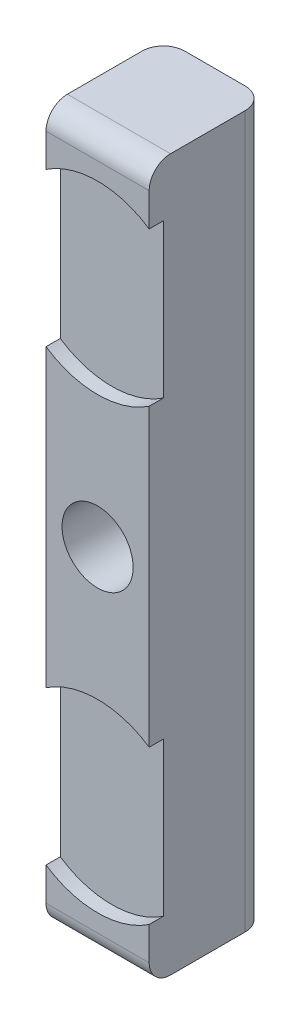
from build123d import *

# Parameters (mm, degrees)
SKETCH7_W           = 100
SKETCH7_H           = 14.5
BOSS_EXTRUDE1_DEPTH = 16.5
SKETCH8_R           = 5
CUT_EXTRUDE2_DEPTH  = 13
SKETCH10_R          = 13
CUT_EXTRUDE3_DEPTH  = 2
FILLET1_R           = 3
FILLET3_R           = 3
FILLET4_R           = 3
FILLET5_R           = 3


with BuildPart() as part:
    # Sketch7 → Boss-Extrude1 (new body)
    with BuildSketch(Plane(origin=(0, 0, 0), x_dir=(0, 1, 0), z_dir=(0, 0, 1))):
        Rectangle(SKETCH7_W, SKETCH7_H)
    extrude(amount=BOSS_EXTRUDE1_DEPTH)

    # Sketch8 → Cut-Extrude2 (cut)
    with BuildSketch(Plane(origin=(0, 0, 16.5), x_dir=(0, -1, 0), z_dir=(0, 0, 1))):
        with Locations(Location((0, 0, 0), (0, 0, 90))):
            Circle(SKETCH8_R)
    extrude(amount=-CUT_EXTRUDE2_DEPTH, mode=Mode.SUBTRACT)

    # Sketch10 → Cut-Extrude3 (cut)
    with BuildSketch(Plane.XY.offset(16.5)):
        with Locations((0, -31.55)):
            Circle(SKETCH10_R)
    cut_extrude3 = extrude(amount=-CUT_EXTRUDE3_DEPTH, mode=Mode.SUBTRACT)

    # Mirror1: Cut-Extrude3 across plane
    add(cut_extrude3.mirror(Plane.ZX), mode=Mode.SUBTRACT)

    # Fillet1
    fillet1_edges = [part.edges().sort_by_distance(p)[0] for p in [
        (-7.25, 0, 0),
    ]]
    fillet(fillet1_edges, radius=FILLET1_R)

    # Fillet3
    fillet3_edges = [part.edges().sort_by_distance(p)[0] for p in [
        (7.25, 0, 0),
    ]]
    fillet(fillet3_edges, radius=FILLET3_R)

    # Fillet4
    fillet4_edges = [part.edges().sort_by_distance(p)[0] for p in [
        (0, 50, 16.5),
    ]]
    fillet(fillet4_edges, radius=FILLET4_R)

    # Fillet5
    fillet5_edges = [part.edges().sort_by_distance(p)[0] for p in [
        (0, -50, 16.5),
    ]]
    fillet(fillet5_edges, radius=FILLET5_R)


solid = part.part
